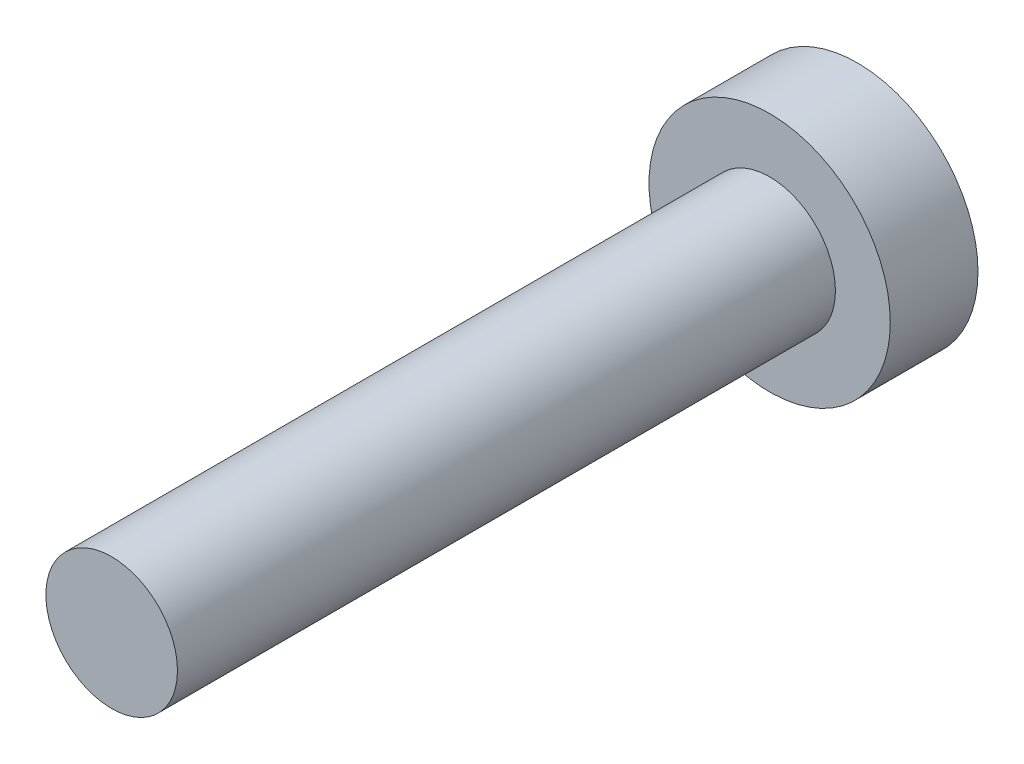
from build123d import *

# Parameters (mm, degrees)
ESQUISSE1_R        = 2.75
BOSS_EXTRU_1_DEPTH = 2
ESQUISSE2_R        = 1.5
BOSS_EXTRU_2_DEPTH = 15


with BuildPart() as part:
    # Esquisse1 → Boss.-Extru.1 (new body)
    with BuildSketch(Plane.XY):
        Circle(ESQUISSE1_R)
    extrude(amount=BOSS_EXTRU_1_DEPTH)

    # Esquisse2 → Boss.-Extru.2 (add)
    with BuildSketch(Plane.XY.offset(2)):
        Circle(ESQUISSE2_R)
    extrude(amount=BOSS_EXTRU_2_DEPTH)


solid = part.part
